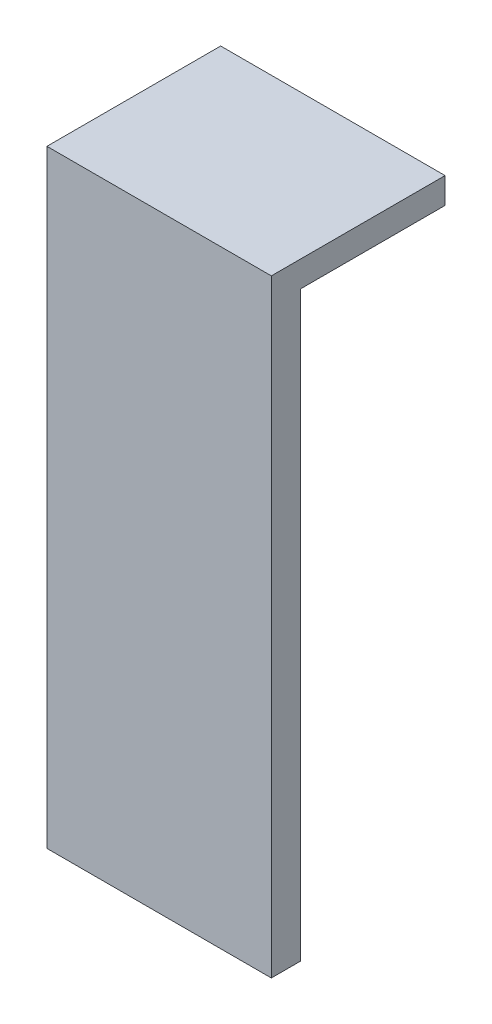
from build123d import *

# Parameters (mm, degrees)
SKETCH1_W           = 7.874
SKETCH1_H           = 1.016
BOSS_EXTRUDE1_DEPTH = 21.336
SKETCH2_W           = 7.874
SKETCH2_H           = 0.908244578
BOSS_EXTRUDE2_DEPTH = 5.08


with BuildPart() as part:
    # Sketch1 → Boss-Extrude1 (new body)
    with BuildSketch(Plane(origin=(0, 0, 0), x_dir=(1, 0, 0), z_dir=(0, 1, 0))):
        with Locations((-0.3175, 0.508)):
            Rectangle(SKETCH1_W, SKETCH1_H)
    extrude(amount=BOSS_EXTRUDE1_DEPTH)

    # Sketch2 → Boss-Extrude2 (add)
    with BuildSketch(Plane(origin=(0, 0, -1.016), x_dir=(-1, 0, 0), z_dir=(0, 0, -1))):
        with Locations((0.3175, 20.881877711)):
            Rectangle(SKETCH2_W, SKETCH2_H)
    extrude(amount=BOSS_EXTRUDE2_DEPTH)


solid = part.part
